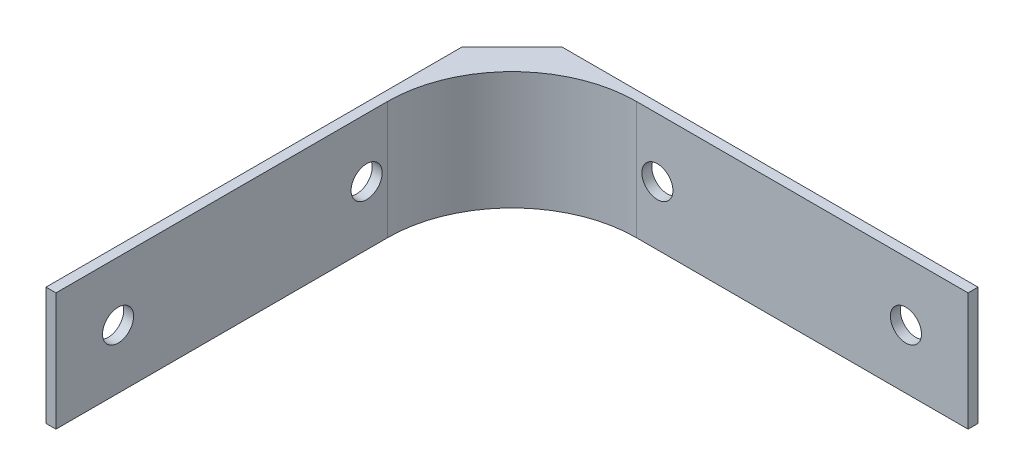
from build123d import *

# Parameters (mm, degrees)
EXTRUDE_2_DEPTH     = 19
SKETCH_2_R          = 2.5
CUT_EXTRUDE_1_DEPTH = 107.646894001
SKETCH_3_R          = 2.5
CUT_EXTRUDE_2_DEPTH = 107.646894001


with BuildPart() as part:
    # 草图1 → 凸台-拉伸2 (new body)
    with BuildSketch(Plane(origin=(0, 0, 0), x_dir=(1, 0, 0), z_dir=(0, 1, 0))):
        with BuildLine():
            Line((75, 0), (8, 0))
            Line((8, 0), (0, -8))
            Line((0, -8), (0, -75))
            Line((0, -75), (1.6, -75))
            Line((1.6, -75), (1.6, -21.6))
            ThreePointArc((1.6, -21.6), (7.457864376, -7.457864376), (21.6, -1.6))
            Line((21.6, -1.6), (75, -1.6))
            Line((75, -1.6), (75, 0))
        make_face()
    extrude(amount=EXTRUDE_2_DEPTH)

    # 草图2 → 切除-拉伸1 (cut, through all)
    with BuildSketch(Plane.XY.offset(1.6)):
        with Locations((25, 9.5)):
            Circle(SKETCH_2_R)
        with Locations((65, 9.5)):
            Circle(SKETCH_2_R)
    extrude(amount=-CUT_EXTRUDE_1_DEPTH, mode=Mode.SUBTRACT)

    # 草图3 → 切除-拉伸2 (cut, through all)
    with BuildSketch(Plane(origin=(1.6, 0, 0), x_dir=(0, 0, -1), z_dir=(1, 0, 0))):
        with Locations((-65, 9.5)):
            Circle(SKETCH_3_R)
        with Locations((-25, 9.5)):
            Circle(SKETCH_3_R)
    extrude(amount=-CUT_EXTRUDE_2_DEPTH, mode=Mode.SUBTRACT)


solid = part.part
